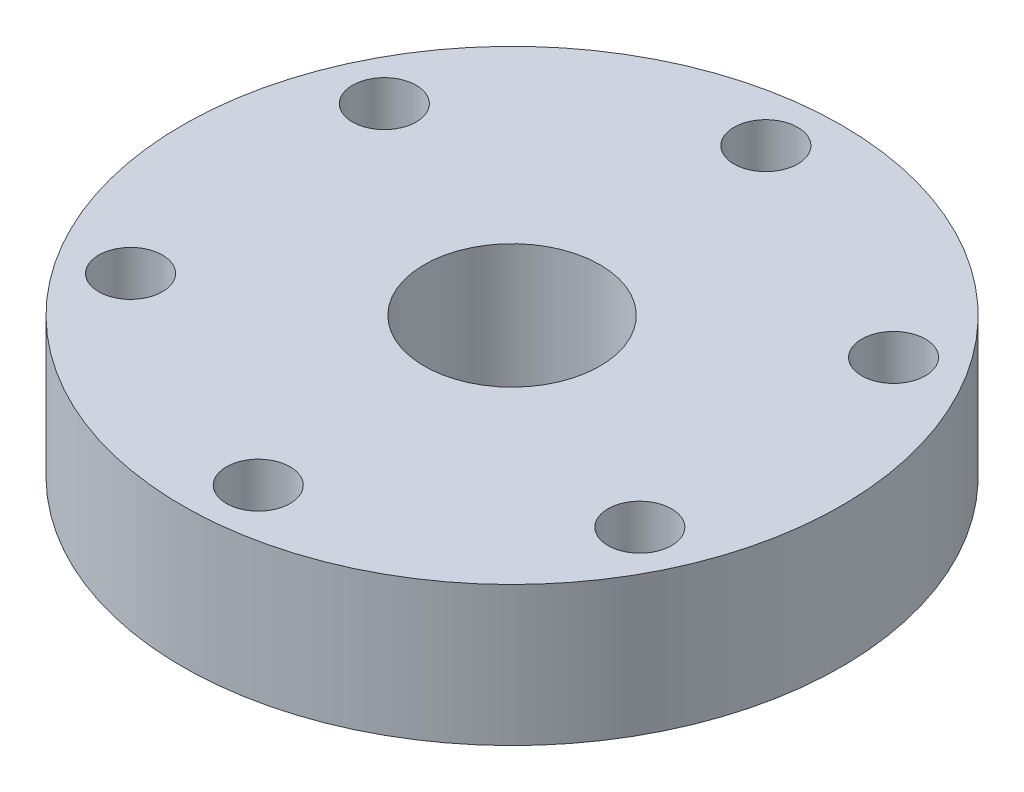
from build123d import *

# Parameters (mm, degrees)
DISCO_START    = 3.175
CROQUIS1_R     = 15
DISCO_DEPTH    = 6.35
BARRENOS_START = 3.175
CROQUIS2_R     = 1.45
CROQUIS2_R_2   = 4
BARRENOS_DEPTH = 6.35


with BuildPart() as part:
    # Croquis1 → Disco (new body)
    with BuildSketch(Plane(origin=(0, 0, 0), x_dir=(1, 0, 0), z_dir=(0, 1, 0)).offset(DISCO_START)):
        with Locations(Location((152.4, -336.55, 0), (0, 0, 90))):
            Circle(CROQUIS1_R)
    extrude(amount=DISCO_DEPTH)

    # Croquis2 → Barrenos (cut)
    with BuildSketch(Plane(origin=(0, 0, 0), x_dir=(1, 0, 0), z_dir=(0, 1, 0)).offset(BARRENOS_START)):
        with Locations(Location((163.653984643, -341.990388742, 0), (0, 0, 90))):
            Circle(CROQUIS2_R)
        with Locations(Location((153.315477464, -349.016430965, 0), (0, 0, 90))):
            Circle(CROQUIS2_R)
        with Locations(Location((142.061492822, -343.576042223, 0), (0, 0, 90))):
            Circle(CROQUIS2_R)
        with Locations(Location((141.146015357, -331.109611258, 0), (0, 0, 90))):
            Circle(CROQUIS2_R)
        with Locations(Location((151.484522536, -324.083569035, 0), (0, 0, 90))):
            Circle(CROQUIS2_R)
        with Locations(Location((162.738507178, -329.523957777, 0), (0, 0, 90))):
            Circle(CROQUIS2_R)
        with Locations(Location((152.4, -336.55, 0), (0, 0, 90))):
            Circle(CROQUIS2_R_2)
    extrude(amount=BARRENOS_DEPTH, mode=Mode.SUBTRACT)


solid = part.part
